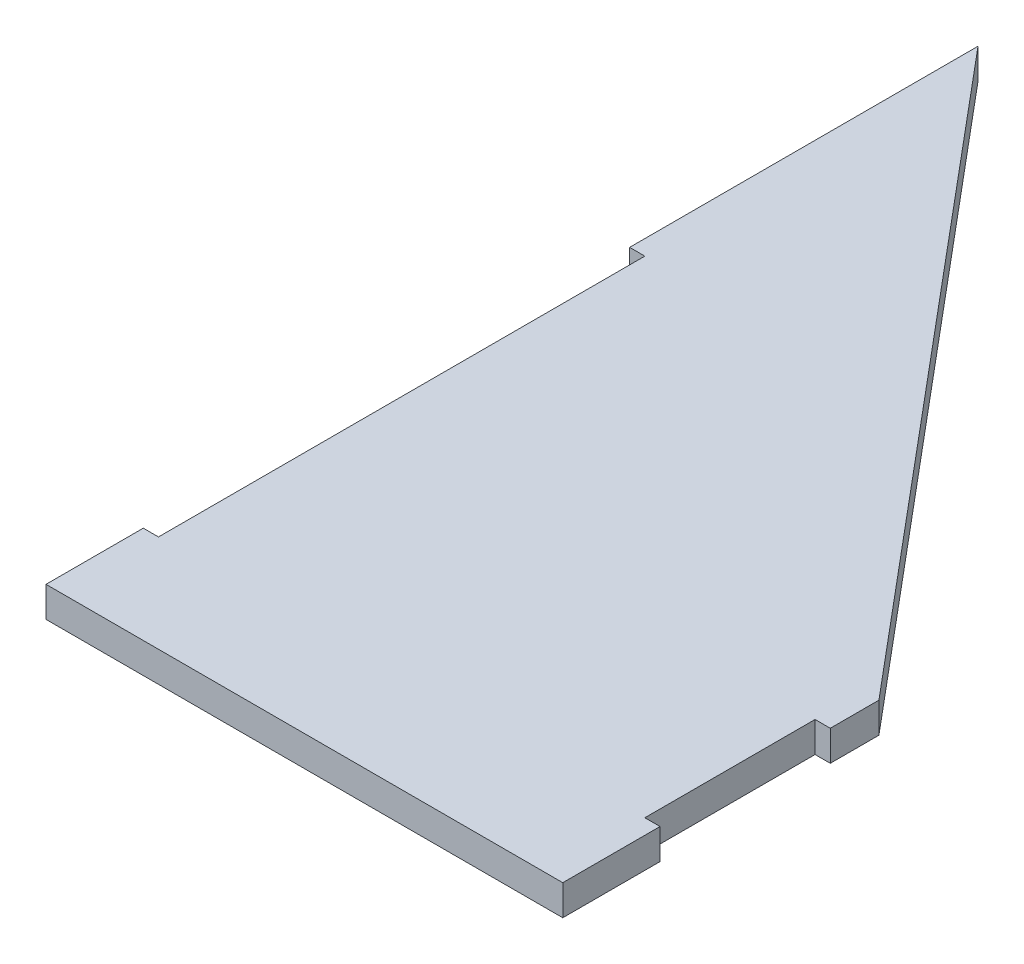
from build123d import *

# Parameters (mm, degrees)
BOSS_EXTRUDE1_DEPTH = 1.5875


with BuildPart() as part:
    # Sketch1 → Boss-Extrude1 (new body)
    with BuildSketch(Plane(origin=(0, 0, 0), x_dir=(1, 0, 0), z_dir=(0, 1, 0))):
        Polygon((-13.49375, -3.175), (-13.49375, -8.255), (13.49375, -8.255), (13.49375, -3.175), (12.7, -3.175), (12.7, 5.715), (13.49375, 5.715), (13.49375, 8.255), (-13.49375, 40.41745008), (-13.49375, 22.225), (-12.7, 22.225), (-12.7, -3.175), align=None)
    extrude(amount=BOSS_EXTRUDE1_DEPTH)


solid = part.part
